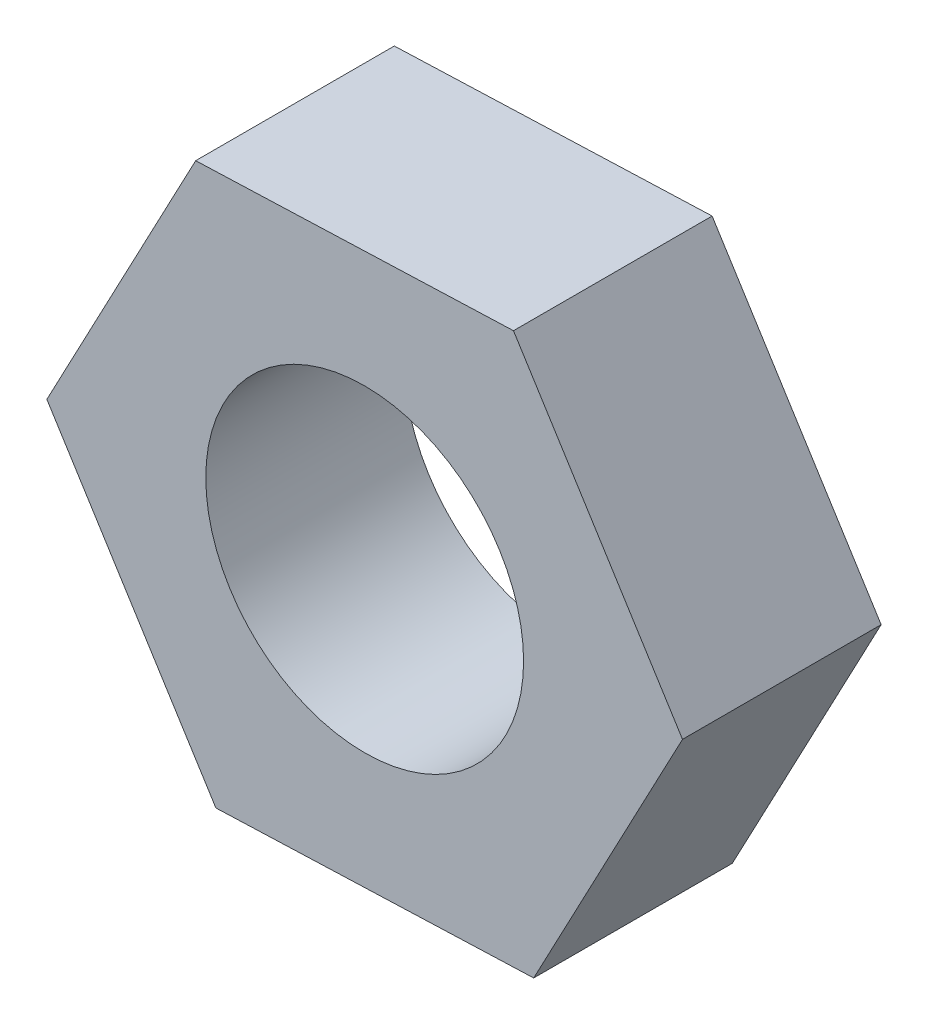
from build123d import *

# Parameters (mm, degrees)
EXTRUDE_1_DEPTH     = 3
SKETCH_2_R          = 2.4
CUT_EXTRUDE_1_DEPTH = 3


with BuildPart() as part:
    # 草图1 → 凸台-拉伸1 (new body)
    with BuildSketch(Plane.XY):
        Polygon((2.247374334, 4.245040408), (-2.552625666, 4.068803469), (-4.8, -0.176236939), (-2.247374334, -4.245040408), (2.552625666, -4.068803469), (4.8, 0.176236939), align=None)
    extrude(amount=EXTRUDE_1_DEPTH)

    # 草图2 → 切除-拉伸1 (cut)
    with BuildSketch(Plane(origin=(0, 0, 0), x_dir=(-1, 0, 0), z_dir=(0, 0, -1))):
        Circle(SKETCH_2_R)
    extrude(amount=-CUT_EXTRUDE_1_DEPTH, mode=Mode.SUBTRACT)


solid = part.part
